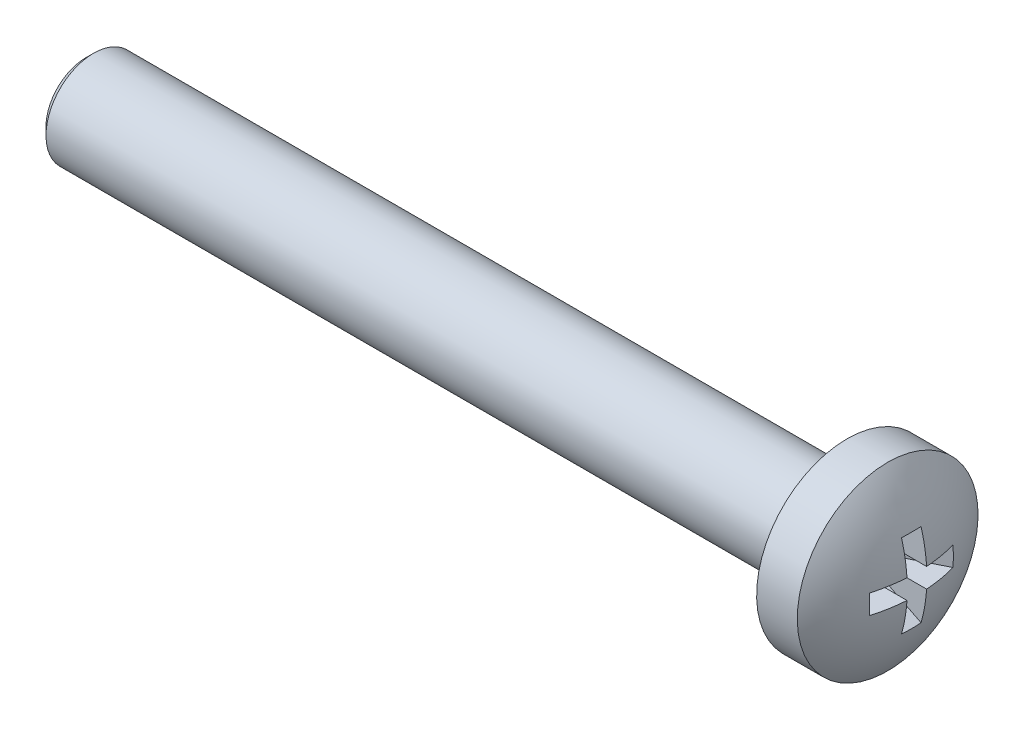
from build123d import *

# Parameters (mm, degrees)
SKETCH2_W          = 1.835
SKETCH2_H          = 1.03
SKETCH2_W_2        = 1.03
SKETCH2_H_2        = 1.835
CUT_EXTRUDE1_DEPTH = 2.74
CHAMFER1_SIZE      = 0.4
DRAFT1_ANGLE       = 26.5


with BuildPart() as part:
    # Sketch1 → Revolve1 (revolve)
    with BuildSketch(Plane.XY):
        with BuildLine():
            Line((-43.7, 0), (-43.7, 2.5))
            Line((-43.7, 2.5), (-3.7, 2.5))
            Line((-3.7, 2.5), (-3.7, 4.75))
            Line((-3.7, 4.75), (-1.562803405, 4.75))
            ThreePointArc((-1.562803405, 4.75), (-0.400737774, 2.500242712), (0, 0))
            Line((0, 0), (-43.7, 0))
        make_face()
    revolve(axis=Axis((0, 0, 0), (-1, 0, 0)))

    # Sketch2 → Cut-Extrude1 (cut)
    with BuildSketch(Plane(origin=(0, 0, 0), x_dir=(0, 0, -1), z_dir=(1, 0, 0))):
        with Locations((-1.4325, 0)):
            Rectangle(SKETCH2_W, SKETCH2_H)
        with Locations((0, 1.4325)):
            Rectangle(SKETCH2_W_2, SKETCH2_H_2)
        Rectangle(SKETCH2_W_2, SKETCH2_H)
        with Locations((0, -1.4325)):
            Rectangle(SKETCH2_W_2, SKETCH2_H_2)
        with Locations((1.4325, 0)):
            Rectangle(SKETCH2_W, SKETCH2_H)
    extrude(amount=-CUT_EXTRUDE1_DEPTH, mode=Mode.SUBTRACT)

    # Chamfer1
    chamfer1_edges = [part.edges().sort_by_distance(p)[0] for p in [
        (-43.7, -2.5, 0),
    ]]
    chamfer(chamfer1_edges, length=CHAMFER1_SIZE)

    # Draft1
    draft1_faces = [part.faces().sort_by_distance(p)[0] for p in [
        (-1.549357489, 0, -2.35),
        (-1.549357489, -2.35, 0),
        (-1.549357489, 2.35, 0),
        (-1.549357489, 0, 2.35),
    ]]
    draft(draft1_faces, Plane(origin=(0, 0, 0), x_dir=(0, 0, 1), z_dir=(1, 0, 0)), DRAFT1_ANGLE)


solid = part.part
